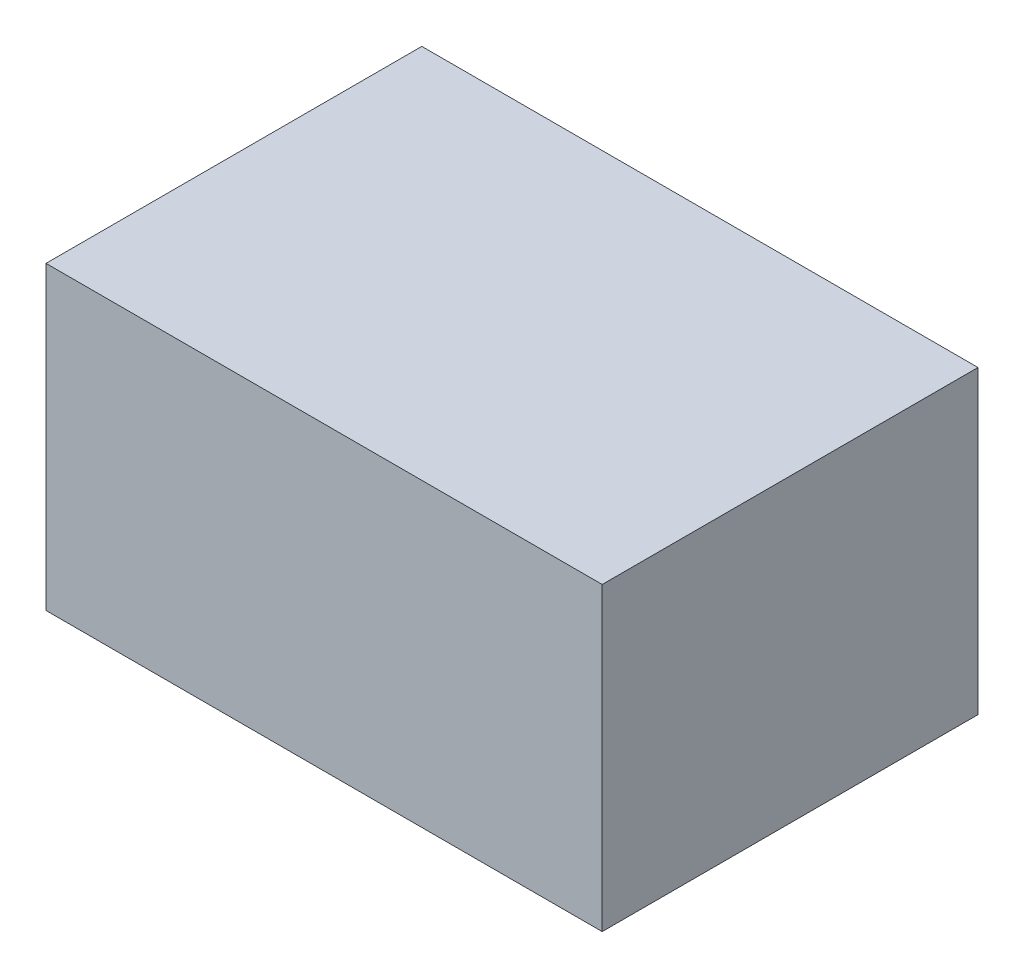
from build123d import *

# Parameters (mm, degrees)
SKETCH1_W           = 50
SKETCH1_H           = 40
BOSS_EXTRUDE1_DEPTH = 37


with BuildPart() as part:
    # Sketch1 → Boss-Extrude1 (new, symmetric)
    with BuildSketch(Plane(origin=(0, 0, 0), x_dir=(0, 0, -1), z_dir=(1, 0, 0))):
        with Locations((25, 20)):
            Rectangle(SKETCH1_W, SKETCH1_H)
    extrude(amount=BOSS_EXTRUDE1_DEPTH, both=True)


solid = part.part
